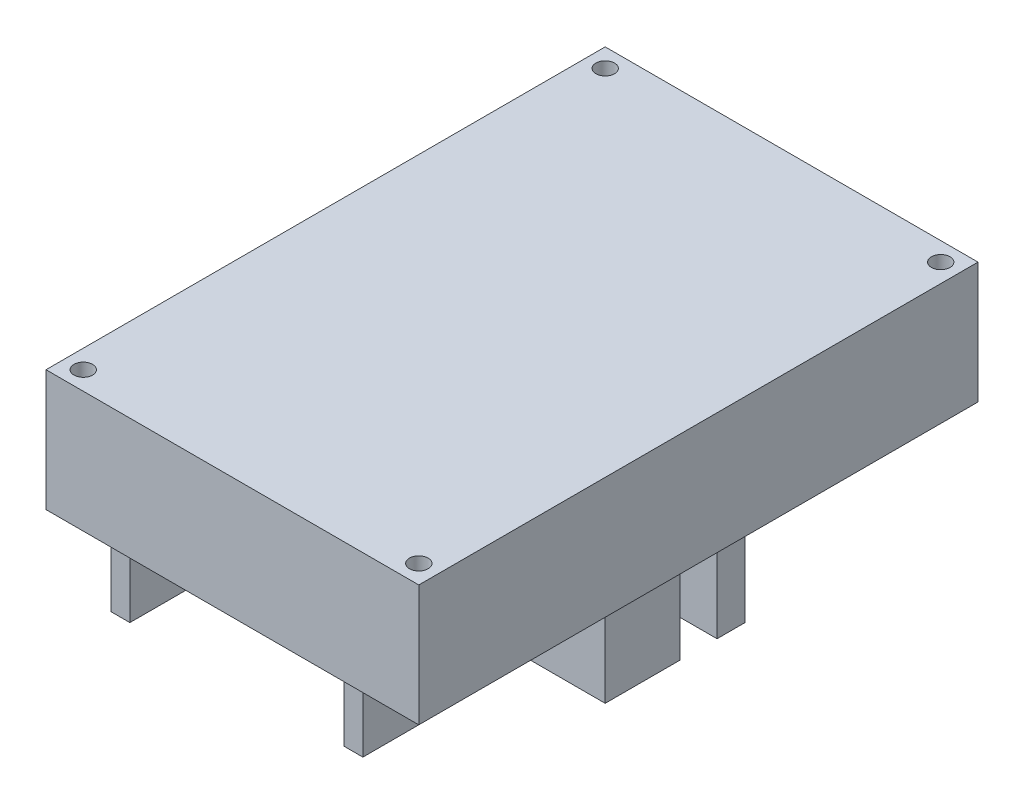
from build123d import *

# Parameters (mm, degrees)
ESQUISSE1_W        = 40
ESQUISSE1_H        = 60
ESQUISSE1_R        = 1
BOSS_EXTRU_1_DEPTH = 6.5
ESQUISSE3_W        = 8
ESQUISSE3_H        = 8
ESQUISSE3_H_2      = 3
ESQUISSE3_W_2      = 2
ESQUISSE3_H_3      = 47
BOSS_EXTRU_2_DEPTH = 10


with BuildPart() as part:
    # Esquisse1 → Boss.-Extru.1 (new, symmetric)
    with BuildSketch(Plane(origin=(0, 0, 0), x_dir=(1, 0, 0), z_dir=(0, 1, 0))):
        Rectangle(ESQUISSE1_W, ESQUISSE1_H)
        with Locations(Location((-18, 28, 0), (0, 0, 90))):
            Circle(ESQUISSE1_R, mode=Mode.SUBTRACT)
        with Locations(Location((18, 28, 0), (0, 0, 90))):
            Circle(ESQUISSE1_R, mode=Mode.SUBTRACT)
        with Locations(Location((18, -28, 0), (0, 0, 90))):
            Circle(ESQUISSE1_R, mode=Mode.SUBTRACT)
        with Locations(Location((-18, -28, 0), (0, 0, 90))):
            Circle(ESQUISSE1_R, mode=Mode.SUBTRACT)
    extrude(amount=BOSS_EXTRU_1_DEPTH, both=True)

    # Esquisse3 → Boss.-Extru.2 (add)
    with BuildSketch(Plane.XZ.offset(6.5)):
        with Locations((14, 4)):
            Rectangle(ESQUISSE3_W, ESQUISSE3_H)
        with Locations((14, -5.5)):
            Rectangle(ESQUISSE3_W, ESQUISSE3_H_2)
        with Locations((9, 2.5)):
            Rectangle(ESQUISSE3_W_2, ESQUISSE3_H_3)
        with Locations((-16, 2.5)):
            Rectangle(ESQUISSE3_W_2, ESQUISSE3_H_3)
    extrude(amount=BOSS_EXTRU_2_DEPTH)


solid = part.part
